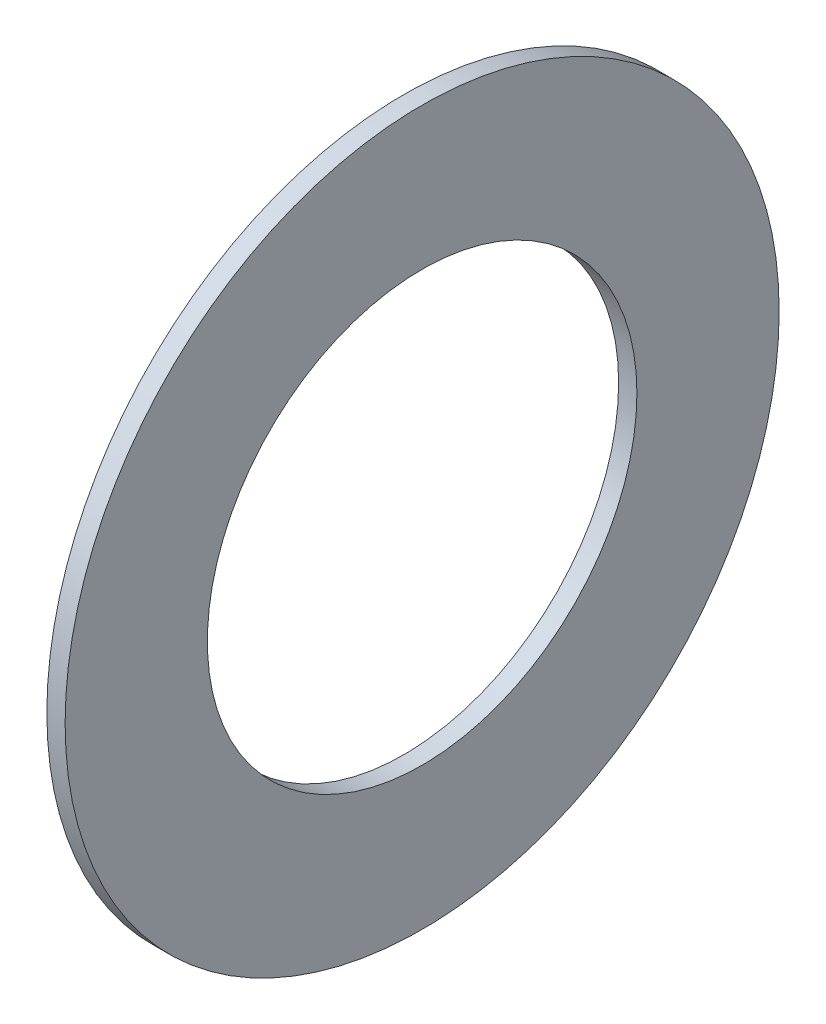
from build123d import *

# Parameters (mm, degrees)
SKETCH1_R      = 15.875
SKETCH1_R_2    = 9.5504
EXTRUDE1_DEPTH = 0.8128


with BuildPart() as part:
    # Sketch1 → Extrude1 (new body)
    with BuildSketch(Plane(origin=(0, 0, 0), x_dir=(0, 0, -1), z_dir=(1, 0, 0))):
        Circle(SKETCH1_R)
        Circle(SKETCH1_R_2, mode=Mode.SUBTRACT)
    extrude(amount=EXTRUDE1_DEPTH)


solid = part.part
